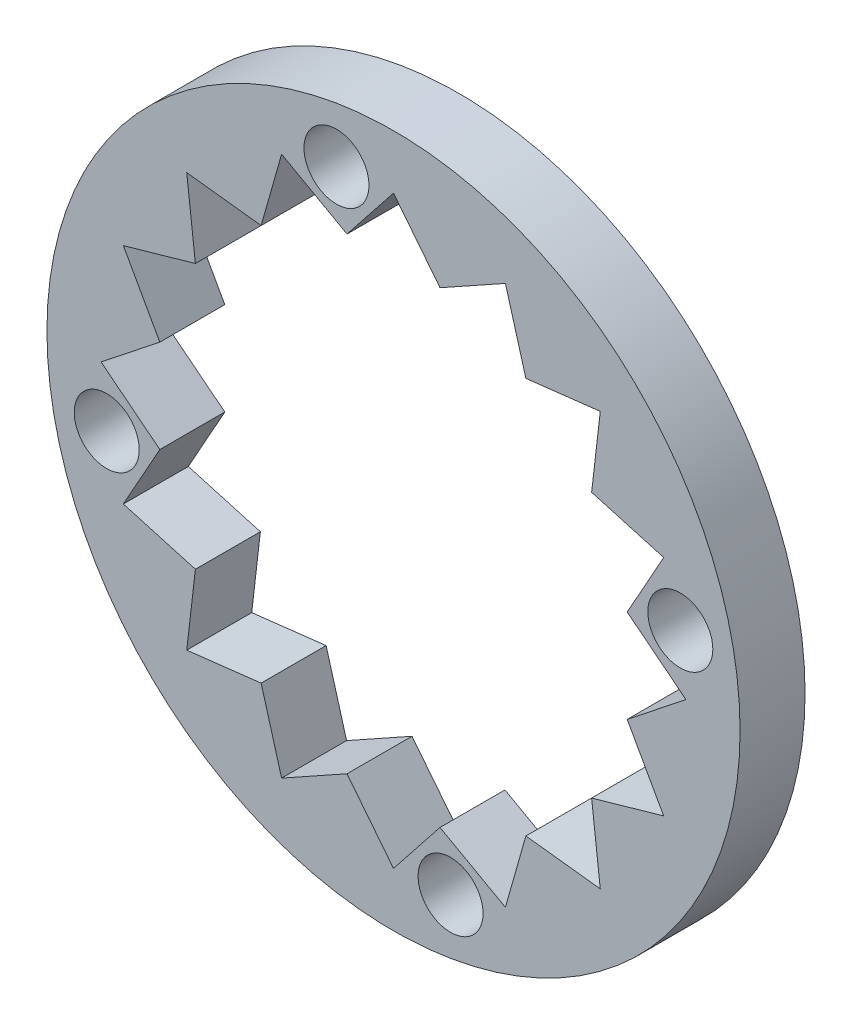
from build123d import *

# Parameters (mm, degrees)
ESBO_O1_R                = 32
ESBO_O1_R_2              = 27
RESSALTO_EXTRUS_O2_DEPTH = 6
ESBO_O3_R                = 3
CORTE_EXTRUS_O1_DEPTH    = 46.650848842
ESBO_O4_R                = 3
ESBO_O4_R_2              = 3.281084103
RESSALTO_EXTRUS_O3_DEPTH = 6


with BuildPart() as part:
    # Esboço1 → Ressalto-extrusão2 (new body)
    # profile 1 of 17: a face of its own
    with BuildSketch(Plane.XY):
        Circle(ESBO_O1_R)
        Circle(ESBO_O1_R_2, mode=Mode.SUBTRACT)
    # profile 2 of 17: a face of its own
    with BuildSketch(Plane.XY):
        with BuildLine():
            Line((-4.291987084, 21.577276169), (0, 27))
            ThreePointArc((0, 27), (-5.267438694, 26.481202571), (-10.332452674, 24.944747378))
            Line((-10.332452674, 24.944747378), (-4.291987084, 21.577276169))
        make_face()
    # profile 3 of 17: a face of its own
    with BuildSketch(Plane.XY):
        with BuildLine():
            Line((-12.222545126, 18.292331471), (-10.332452674, 24.944747378))
            ThreePointArc((-10.332452674, 24.944747378), (-15.000396292, 22.449679532), (-19.091883092, 19.091883092))
            Line((-19.091883092, 19.091883092), (-12.222545126, 18.292331471))
        make_face()
    # profile 4 of 17: a face of its own
    with BuildSketch(Plane.XY):
        with BuildLine():
            Line((-18.292331471, 12.222545126), (-19.091883092, 19.091883092))
            ThreePointArc((-19.091883092, 19.091883092), (-22.449679532, 15.000396292), (-24.944747378, 10.332452674))
            Line((-24.944747378, 10.332452674), (-18.292331471, 12.222545126))
        make_face()
    # profile 5 of 17: a face of its own
    with BuildSketch(Plane.XY):
        with BuildLine():
            Line((-21.577276169, 4.291987084), (-24.944747378, 10.332452674))
            ThreePointArc((-24.944747378, 10.332452674), (-26.481202571, 5.267438694), (-27, 0))
            Line((-27, 0), (-21.577276169, 4.291987084))
        make_face()
    # profile 6 of 17: a face of its own
    with BuildSketch(Plane.XY):
        with BuildLine():
            Line((-21.577276169, -4.291987084), (-27, 0))
            ThreePointArc((-27, 0), (-26.481202571, -5.267438694), (-24.944747378, -10.332452674))
            Line((-24.944747378, -10.332452674), (-21.577276169, -4.291987084))
        make_face()
    # profile 7 of 17: a face of its own
    with BuildSketch(Plane.XY):
        with BuildLine():
            Line((-18.292331471, -12.222545126), (-24.944747378, -10.332452674))
            ThreePointArc((-24.944747378, -10.332452674), (-22.449679532, -15.000396292), (-19.091883092, -19.091883092))
            Line((-19.091883092, -19.091883092), (-18.292331471, -12.222545126))
        make_face()
    # profile 8 of 17: a face of its own
    with BuildSketch(Plane.XY):
        with BuildLine():
            Line((-12.222545126, -18.292331471), (-19.091883092, -19.091883092))
            ThreePointArc((-19.091883092, -19.091883092), (-15.000396292, -22.449679532), (-10.332452674, -24.944747378))
            Line((-10.332452674, -24.944747378), (-12.222545126, -18.292331471))
        make_face()
    # profile 9 of 17: a face of its own
    with BuildSketch(Plane.XY):
        with BuildLine():
            Line((-4.291987084, -21.577276169), (-10.332452674, -24.944747378))
            ThreePointArc((-10.332452674, -24.944747378), (-5.267438694, -26.481202571), (0, -27))
            Line((0, -27), (-4.291987084, -21.577276169))
        make_face()
    # profile 10 of 17: a face of its own
    with BuildSketch(Plane.XY):
        with BuildLine():
            ThreePointArc((0, -27), (5.267438694, -26.481202571), (10.332452674, -24.944747378))
            Line((10.332452674, -24.944747378), (4.291987084, -21.577276169))
            Line((4.291987084, -21.577276169), (0, -27))
        make_face()
    # profile 11 of 17: a face of its own
    with BuildSketch(Plane.XY):
        with BuildLine():
            ThreePointArc((10.332452674, -24.944747378), (15.000396292, -22.449679532), (19.091883092, -19.091883092))
            Line((19.091883092, -19.091883092), (12.222545126, -18.292331471))
            Line((12.222545126, -18.292331471), (10.332452674, -24.944747378))
        make_face()
    # profile 12 of 17: a face of its own
    with BuildSketch(Plane.XY):
        with BuildLine():
            ThreePointArc((19.091883092, -19.091883092), (22.449679532, -15.000396292), (24.944747378, -10.332452674))
            Line((24.944747378, -10.332452674), (18.292331471, -12.222545126))
            Line((18.292331471, -12.222545126), (19.091883092, -19.091883092))
        make_face()
    # profile 13 of 17: a face of its own
    with BuildSketch(Plane.XY):
        with BuildLine():
            ThreePointArc((24.944747378, -10.332452674), (26.481202571, -5.267438694), (27, 0))
            Line((27, 0), (21.577276169, -4.291987084))
            Line((21.577276169, -4.291987084), (24.944747378, -10.332452674))
        make_face()
    # profile 14 of 17: a face of its own
    with BuildSketch(Plane.XY):
        with BuildLine():
            ThreePointArc((27, 0), (26.481202571, 5.267438694), (24.944747378, 10.332452674))
            Line((24.944747378, 10.332452674), (21.577276169, 4.291987084))
            Line((21.577276169, 4.291987084), (27, 0))
        make_face()
    # profile 15 of 17: a face of its own
    with BuildSketch(Plane.XY):
        with BuildLine():
            ThreePointArc((24.944747378, 10.332452674), (22.449679532, 15.000396292), (19.091883092, 19.091883092))
            Line((19.091883092, 19.091883092), (18.292331471, 12.222545126))
            Line((18.292331471, 12.222545126), (24.944747378, 10.332452674))
        make_face()
    # profile 16 of 17: a face of its own
    with BuildSketch(Plane.XY):
        with BuildLine():
            ThreePointArc((19.091883092, 19.091883092), (15.000396292, 22.449679532), (10.332452674, 24.944747378))
            Line((10.332452674, 24.944747378), (12.222545126, 18.292331471))
            Line((12.222545126, 18.292331471), (19.091883092, 19.091883092))
        make_face()
    # profile 17 of 17: a face of its own
    with BuildSketch(Plane.XY):
        with BuildLine():
            ThreePointArc((10.332452674, 24.944747378), (5.267438694, 26.481202571), (0, 27))
            Line((0, 27), (4.291987084, 21.577276169))
            Line((4.291987084, 21.577276169), (10.332452674, 24.944747378))
        make_face()
    extrude(amount=RESSALTO_EXTRUS_O2_DEPTH)

    # Esboço3 → Corte-extrusão1 (cut, through all)
    with BuildSketch(Plane.XY.offset(6)):
        with Locations((-5.267438694, 26.481202571)):
            Circle(ESBO_O3_R)
        with Locations((5.267438694, -26.481202571)):
            Circle(ESBO_O3_R)
        with Locations((26.481202571, 5.267438694)):
            Circle(ESBO_O3_R)
        with Locations((-26.481202571, -5.267438694)):
            Circle(ESBO_O3_R)
        with Locations((22.449679532, -15.000396292)):
            Circle(ESBO_O3_R)
        with Locations((-22.449679532, 15.000396292)):
            Circle(ESBO_O3_R)
    extrude(amount=-CORTE_EXTRUS_O1_DEPTH, mode=Mode.SUBTRACT)

    # Esboço4 → Ressalto-extrusão3 (add)
    with BuildSketch(Plane.XY.offset(6)):
        with Locations((-22.449679532, 15.000396292)):
            Circle(ESBO_O4_R)
        with Locations((22.424396541, -15.280341006)):
            Circle(ESBO_O4_R_2)
    extrude(amount=-RESSALTO_EXTRUS_O3_DEPTH)


solid = part.part
